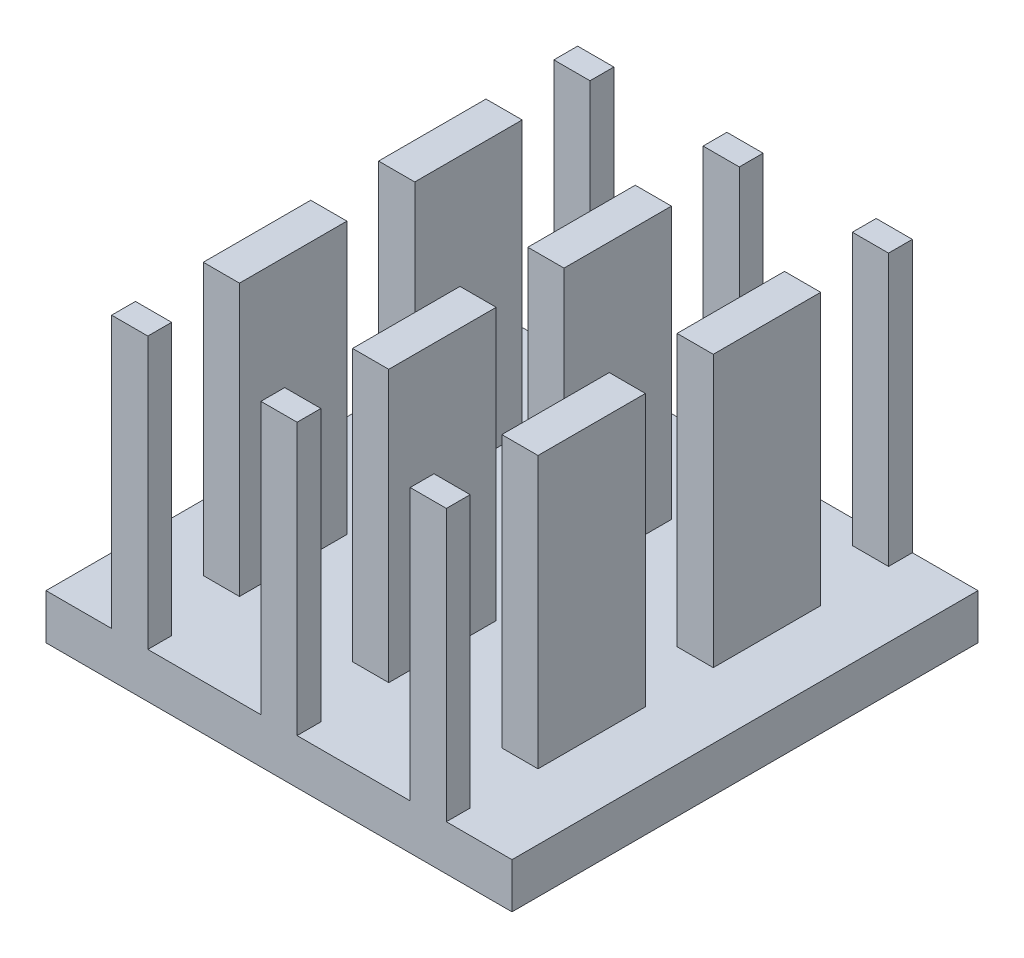
from build123d import *

# Parameters (mm, degrees)
BOSS_EXTRUDE1_DEPTH = 14
SKETCH2_W           = 1.5
SKETCH2_H           = 6
CUT_EXTRUDE1_DEPTH  = 22
SKETCH12_W          = 14
SKETCH12_H          = 14
SKETCH12_W_2        = 10.30277124
SKETCH12_H_2        = 10.30277124
CUT_EXTRUDE2_DEPTH  = 18.146428199


with BuildPart() as part:
    # Sketch1 → Boss-Extrude1 (new body)
    with BuildSketch(Plane.XY):
        Polygon((-7, 0), (7, 0), (7, 7), (6.2, 7), (6.2, 1), (3.7, 1), (3.7, 7), (2.9, 7), (2.9, 1), (0.4, 1), (0.4, 7), (-0.4, 7), (-0.4, 1), (-2.9, 1), (-2.9, 7), (-3.7, 7), (-3.7, 1), (-6.2, 1), (-6.2, 7), (-7, 7), align=None)
    extrude(amount=BOSS_EXTRUDE1_DEPTH)

    # Sketch2 → Cut-Extrude1 (cut, through all)
    with BuildSketch(Plane.ZY.offset(7)):
        with Locations((3.125, 4)):
            Rectangle(SKETCH2_W, SKETCH2_H)
        with Locations((7, 4)):
            Rectangle(SKETCH2_W, SKETCH2_H)
        with Locations((10.875, 4)):
            Rectangle(SKETCH2_W, SKETCH2_H)
    extrude(amount=-CUT_EXTRUDE1_DEPTH, mode=Mode.SUBTRACT)

    # Sketch12 → Cut-Extrude2 (cut, through all)
    with BuildSketch(Plane.XZ):
        with Locations((0, 7)):
            Rectangle(SKETCH12_W, SKETCH12_H)
        with Locations((0, 7)):
            Rectangle(SKETCH12_W_2, SKETCH12_H_2, mode=Mode.SUBTRACT)
    extrude(amount=-CUT_EXTRUDE2_DEPTH, mode=Mode.SUBTRACT)


solid = part.part
